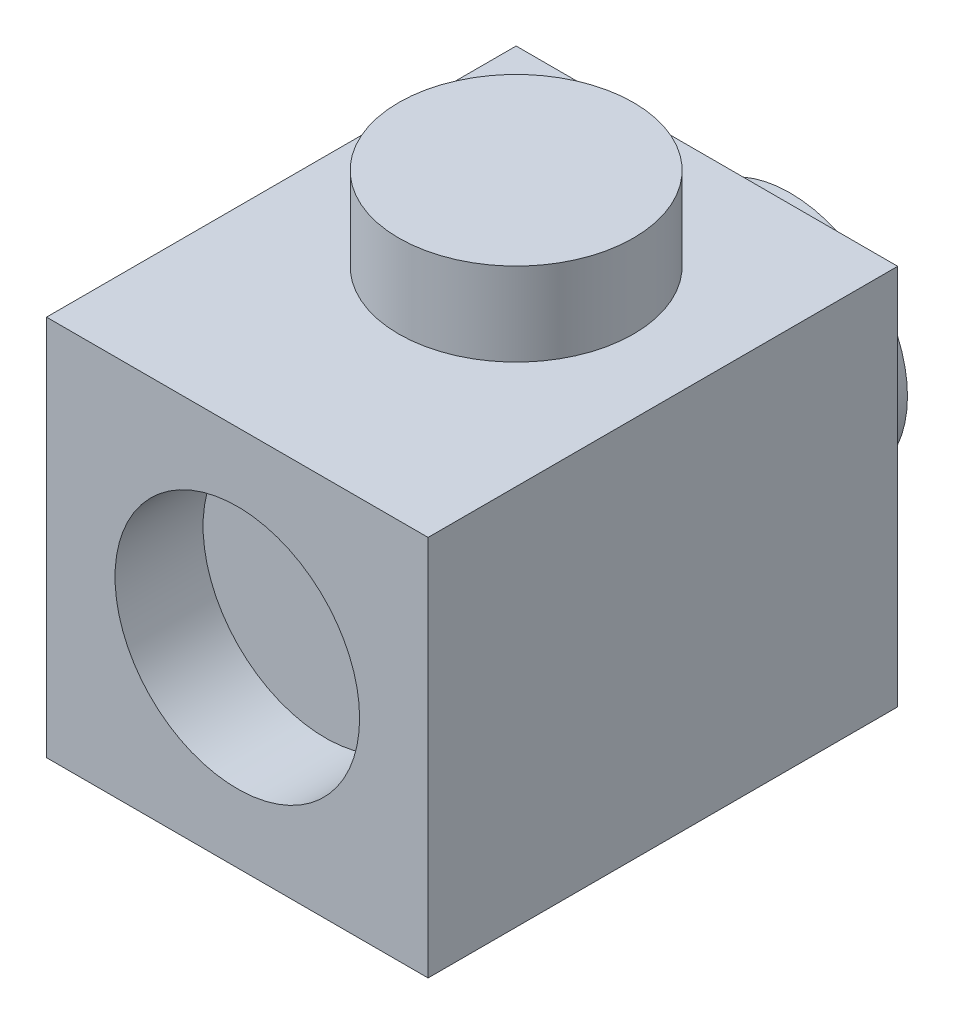
from build123d import *

# Parameters (mm, degrees)
SKETCH_1_W          = 7.8
SKETCH_1_H          = 7.8
EXTRUDE_1_DEPTH     = 9.6
SKETCH_2_R          = 2.4
EXTRUDE_2_DEPTH     = 1.7
SKETCH_3_R          = 2.5
CUT_EXTRUDE_1_DEPTH = 1.8
SKETCH_5_R          = 2.4
EXTRUDE_3_DEPTH     = 1.7


with BuildPart() as part:
    # Эскиз1 → Бобышка-Вытянуть1 (new body)
    with BuildSketch(Plane.XY):
        Rectangle(SKETCH_1_W, SKETCH_1_H)
    extrude(amount=EXTRUDE_1_DEPTH)

    # Эскиз2 → Бобышка-Вытянуть2 (add)
    with BuildSketch(Plane(origin=(0, 0, 0), x_dir=(-1, 0, 0), z_dir=(0, 0, -1))):
        Circle(SKETCH_2_R)
    extrude(amount=EXTRUDE_2_DEPTH)

    # Эскиз3 → Вырез-Вытянуть1 (cut)
    with BuildSketch(Plane.XY.offset(9.6)):
        Circle(SKETCH_3_R)
    extrude(amount=-CUT_EXTRUDE_1_DEPTH, mode=Mode.SUBTRACT)

    # Эскиз5 → Бобышка-Вытянуть3 (add)
    with BuildSketch(Plane(origin=(0, 3.9, 0), x_dir=(1, 0, 0), z_dir=(0, 1, 0))):
        with Locations(Location((0, -3.9, 0), (0, 0, 270))):
            Circle(SKETCH_5_R)
    extrude(amount=EXTRUDE_3_DEPTH)


solid = part.part
